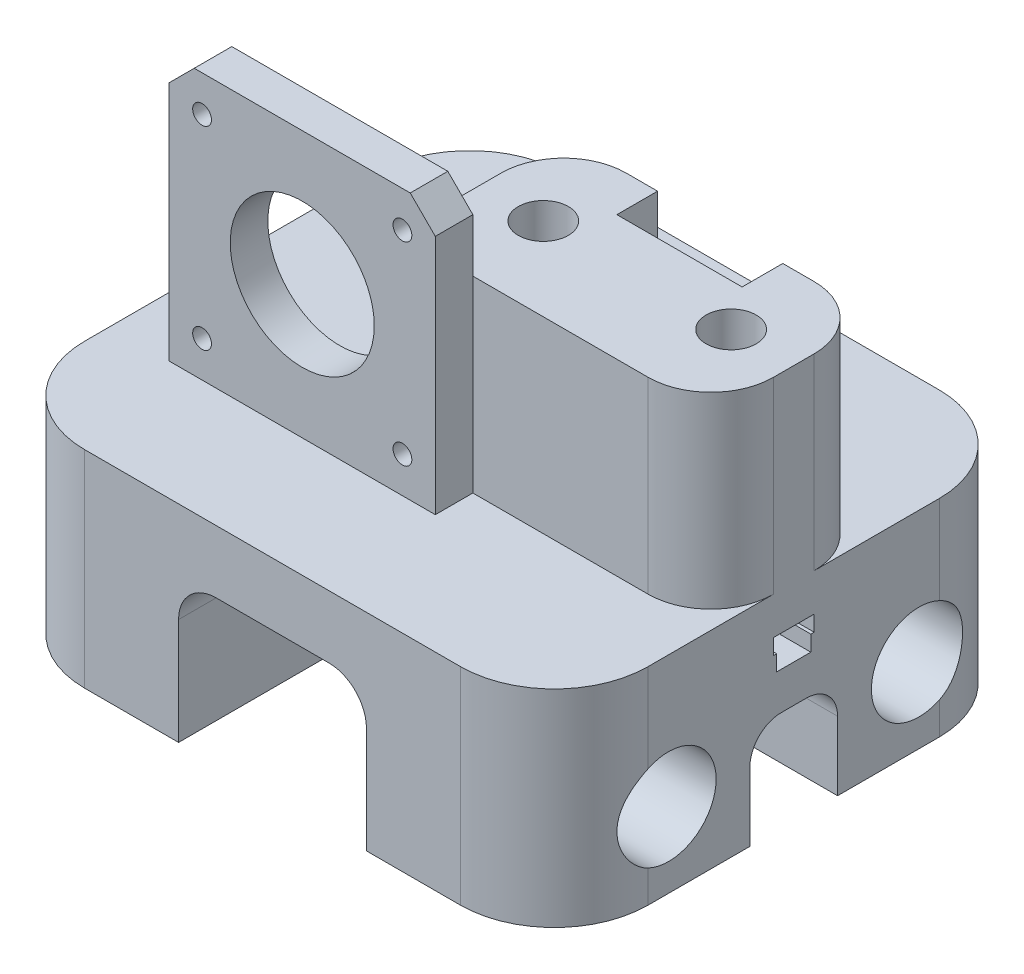
from build123d import *

# Parameters (mm, degrees)
BOSS_EXTRUDE1_DEPTH     = 33
CUT_EXTRUDE1_DEPTH      = 76.5
CUT_EXTRUDE3_DEPTH      = 104.208829564
CUT_EXTRUDE3_DEPTH_BACK = 91
CUT_EXTRUDE4_DEPTH      = 91
CUT_EXTRUDE5_DEPTH      = 25
CUT_EXTRUDE6_START      = -25
SKETCH7_R               = 7.6
CUT_EXTRUDE6_DEPTH      = 25
SKETCH8_W               = 50
SKETCH8_H               = 26.5
SKETCH8_R               = 4
BOSS_EXTRUDE2_DEPTH     = 30
SKETCH12_R              = 11.5
SKETCH12_R_2            = 1.5
BOSS_EXTRUDE5_DEPTH     = 6
SKETCH13_R              = 1
CUT_EXTRUDE7_DEPTH      = 6.5
SKETCH13_3_R            = 1
CUT_EXTRUDE8_DEPTH      = 17
CUT_EXTRUDE9_DEPTH      = 2.5
SKETCH15_5_R            = 1.5
CUT_EXTRUDE12_DEPTH     = 9
CUT_EXTRUDE13_START     = -35
CUT_EXTRUDE13_DEPTH     = 159.544779435
FILLET1_R               = 10
CUT_REVOLVE3_ANGLE      = 90
CUT_EXTRUDE14_DEPTH     = 2
SKETCH29_R              = 2
CUT_EXTRUDE15_DEPTH     = 11


with BuildPart() as part:
    # Sketch1 → Boss-Extrude1 (new body)
    with BuildSketch(Plane(origin=(0, 0, 0), x_dir=(1, 0, 0), z_dir=(0, 1, 0))):
        with BuildLine():
            Line((-15, -7), (-45, -7))
            Line((-45, -7), (-45, -23.25))
            ThreePointArc((-45, -23.25), (-40.606601718, -33.856601718), (-30, -38.25))
            Line((-30, -38.25), (-15, -38.25))
            Line((-15, -38.25), (-15, -7))
        make_face()
        with BuildLine():
            Line((-15, 38.25), (-30, 38.25))
            ThreePointArc((-30, 38.25), (-40.606601718, 33.856601718), (-45, 23.25))
            Line((-45, 23.25), (-45, 7))
            Line((-45, 7), (-15, 7))
            Line((-15, 7), (-15, 38.25))
        make_face()
        with BuildLine():
            Line((45, -23.25), (45, -7))
            Line((45, -7), (15, -7))
            Line((15, -7), (15, -38.25))
            Line((15, -38.25), (30, -38.25))
            ThreePointArc((30, -38.25), (40.606601718, -33.856601718), (45, -23.25))
        make_face()
        with BuildLine():
            Line((30, 38.25), (15, 38.25))
            Line((15, 38.25), (15, 7))
            Line((15, 7), (45, 7))
            Line((45, 7), (45, 23.25))
            ThreePointArc((45, 23.25), (40.606601718, 33.856601718), (30, 38.25))
        make_face()
        Polygon((15, 38.25), (-15, 38.25), (-15, 7), (-45, 7), (-45, -7), (-15, -7), (-15, -38.25), (15, -38.25), (15, -7), (45, -7), (45, 7), (15, 7), align=None)
    extrude(amount=BOSS_EXTRUDE1_DEPTH)

    # Sketch2 → Cut-Extrude1 (cut)
    with BuildSketch(Plane(origin=(0, 0, -38.25), x_dir=(-1, 0, 0), z_dir=(0, 0, -1))):
        with BuildLine():
            Line((-15, 0), (-15, 17))
            ThreePointArc((-15, 17), (-13.242640687, 21.242640687), (-9, 23))
            Line((-9, 23), (9, 23))
            ThreePointArc((9, 23), (13.242640687, 21.242640687), (15, 17))
            Line((15, 17), (15, 0))
            Line((15, 0), (-15, 0))
        make_face()
    extrude(amount=-CUT_EXTRUDE1_DEPTH, mode=Mode.SUBTRACT)

    # Sketch3 → Cut-Extrude3 (cut, two sides: drawn at the far end of the back side and taken through both)
    with BuildSketch(Plane(origin=(45, 0, 0), x_dir=(0, 0, -1), z_dir=(1, 0, 0)).offset(-CUT_EXTRUDE3_DEPTH_BACK)):
        with BuildLine():
            Line((-7, 11), (-7, 0))
            Line((-7, 0), (7, 0))
            Line((7, 0), (7, 11))
            ThreePointArc((7, 11), (5.535533906, 14.535533906), (2, 16))
            Line((2, 16), (-2, 16))
            ThreePointArc((-2, 16), (-5.535533906, 14.535533906), (-7, 11))
        make_face()
    extrude(amount=CUT_EXTRUDE3_DEPTH + CUT_EXTRUDE3_DEPTH_BACK, mode=Mode.SUBTRACT)

    # Sketch5 → Cut-Extrude4 (cut)
    with BuildSketch(Plane(origin=(45, 0, 0), x_dir=(0, 0, -1), z_dir=(1, 0, 0))):
        with BuildLine():
            ThreePointArc((-23.25, 8.200328962), (-17.908349934, 7.458524469), (-15, 12))
            ThreePointArc((-15, 12), (-17.908349934, 16.541475531), (-23.25, 15.799671038))
            Line((-23.25, 15.799671038), (-23.25, 8.200328962))
        make_face()
        with BuildLine():
            Line((-23.25, 8.200328962), (-23.25, 15.799671038))
            ThreePointArc((-23.25, 15.799671038), (-25, 12), (-23.25, 8.200328962))
        make_face()
        with BuildLine():
            ThreePointArc((23.25, 8.200328962), (24.541475531, 9.908349934), (25, 12))
            ThreePointArc((25, 12), (24.541475531, 14.091650066), (23.25, 15.799671038))
            Line((23.25, 15.799671038), (23.25, 8.200328962))
        make_face()
        with BuildLine():
            Line((23.25, 8.200328962), (23.25, 15.799671038))
            ThreePointArc((23.25, 15.799671038), (15, 12), (23.25, 8.200328962))
        make_face()
    extrude(amount=-CUT_EXTRUDE4_DEPTH, mode=Mode.SUBTRACT)

    # Sketch5<3> → Cut-Extrude5 (cut)
    with BuildSketch(Plane(origin=(45, 0, 0), x_dir=(0, 0, -1), z_dir=(1, 0, 0))):
        with BuildLine():
            ThreePointArc((-23.25, 15.799671038), (-17.908349934, 16.541475531), (-15, 12))
            ThreePointArc((-15, 12), (-17.908349934, 7.458524469), (-23.25, 8.200328962))
            Line((-23.25, 8.200328962), (-23.25, 5.129956332))
            ThreePointArc((-23.25, 5.129956332), (-15.93428973, 5.578940897), (-12.4, 12))
            ThreePointArc((-12.4, 12), (-15.93428973, 18.421059103), (-23.25, 18.870043668))
            Line((-23.25, 18.870043668), (-23.25, 15.799671038))
        make_face()
        with BuildLine():
            ThreePointArc((-23.25, 8.200328962), (-25, 12), (-23.25, 15.799671038))
            Line((-23.25, 15.799671038), (-23.25, 18.870043668))
            ThreePointArc((-23.25, 18.870043668), (-27.6, 12), (-23.25, 5.129956332))
            Line((-23.25, 5.129956332), (-23.25, 8.200328962))
        make_face()
        with BuildLine():
            ThreePointArc((23.25, 15.799671038), (24.541475531, 14.091650066), (25, 12))
            ThreePointArc((25, 12), (24.541475531, 9.908349934), (23.25, 8.200328962))
            Line((23.25, 8.200328962), (23.25, 5.129956332))
            ThreePointArc((23.25, 5.129956332), (26.421059103, 7.93428973), (27.6, 12))
            ThreePointArc((27.6, 12), (26.421059103, 16.06571027), (23.25, 18.870043668))
            Line((23.25, 18.870043668), (23.25, 15.799671038))
        make_face()
        with BuildLine():
            ThreePointArc((23.25, 8.200328962), (15, 12), (23.25, 15.799671038))
            Line((23.25, 15.799671038), (23.25, 18.870043668))
            ThreePointArc((23.25, 18.870043668), (12.4, 12), (23.25, 5.129956332))
            Line((23.25, 5.129956332), (23.25, 8.200328962))
        make_face()
    extrude(amount=-CUT_EXTRUDE5_DEPTH, mode=Mode.SUBTRACT)

    # Sketch7 → Cut-Extrude6 (cut)
    with BuildSketch(Plane.ZY.offset(45).offset(CUT_EXTRUDE6_START)):
        with Locations(Location((20, 12, 0), (0, 0, 180))):
            Circle(SKETCH7_R)
        with Locations(Location((-20, 12, 0), (0, 0, 180))):
            Circle(SKETCH7_R)
    extrude(amount=CUT_EXTRUDE6_DEPTH, mode=Mode.SUBTRACT)

    # Sketch8 → Boss-Extrude2 (add)
    with BuildSketch(Plane(origin=(0, 33, 0), x_dir=(1, 0, 0), z_dir=(0, 1, 0))):
        with Locations((20, 0)):
            Rectangle(SKETCH8_W, SKETCH8_H)
        with Locations(Location((5, 0, 0), (0, 0, 270))):
            Circle(SKETCH8_R, mode=Mode.SUBTRACT)
        with Locations(Location((35, 0, 0), (0, 0, 270))):
            Circle(SKETCH8_R, mode=Mode.SUBTRACT)
    extrude(amount=BOSS_EXTRUDE2_DEPTH)

    # Sketch12 → Boss-Extrude5 (add)
    with BuildSketch(Plane.XY.offset(13.25)):
        Polygon((-35.5, 33), (-35.5, 71.5), (-31.5, 75.5), (3, 75.5), (7, 71.5), (7, 33), align=None)
        with Locations(Location((-14.25, 54.25, 0), (0, 0, 36.452681774))):
            Circle(SKETCH12_R, mode=Mode.SUBTRACT)
        with Locations((-30.25, 69.75)):
            Circle(SKETCH12_R_2, mode=Mode.SUBTRACT)
        with Locations((1.75, 69.75)):
            Circle(SKETCH12_R_2, mode=Mode.SUBTRACT)
        with Locations((-30.25, 38.75)):
            Circle(SKETCH12_R_2, mode=Mode.SUBTRACT)
        with Locations((1.75, 38.75)):
            Circle(SKETCH12_R_2, mode=Mode.SUBTRACT)
    extrude(amount=BOSS_EXTRUDE5_DEPTH)

    # Sketch13 → Cut-Extrude7 (cut)
    # profile 1 of 3: a face of its own
    with BuildSketch(Plane(origin=(0, 0, -13.25), x_dir=(-1, 0, 0), z_dir=(0, 0, -1))):
        Polygon((-19, 47.5), (-19, 52.5), (-13, 52.5), (-13, 47.5), (-11, 47.5), (-11, 52.5), (-10, 52.5), (-10, 63), (-30, 63), (-30, 52.5), (-29, 52.5), (-29, 47.5), (-27, 47.5), (-27, 52.5), (-21, 52.5), (-21, 47.5), align=None)
        with Locations((-24.75, 55.7)):
            Circle(SKETCH13_R, mode=Mode.SUBTRACT)
        with Locations((-15.25, 55.7)):
            Circle(SKETCH13_R, mode=Mode.SUBTRACT)
    # profile 2 of 3: a face of its own
    with BuildSketch(Plane(origin=(0, 0, -13.25), x_dir=(-1, 0, 0), z_dir=(0, 0, -1))):
        with Locations((-15.25, 55.7)):
            Circle(SKETCH13_R)
    # profile 3 of 3: a face of its own
    with BuildSketch(Plane(origin=(0, 0, -13.25), x_dir=(-1, 0, 0), z_dir=(0, 0, -1))):
        with Locations((-24.75, 55.7)):
            Circle(SKETCH13_R)
    extrude(amount=-CUT_EXTRUDE7_DEPTH, mode=Mode.SUBTRACT)

    # Sketch13<3> → Cut-Extrude8 (cut)
    with BuildSketch(Plane(origin=(0, 0, -13.25), x_dir=(-1, 0, 0), z_dir=(0, 0, -1))):
        with Locations((-15.25, 55.7)):
            Circle(SKETCH13_3_R)
        with Locations((-24.75, 55.7)):
            Circle(SKETCH13_3_R)
    extrude(amount=-CUT_EXTRUDE8_DEPTH, mode=Mode.SUBTRACT)

    # Sketch15 → Cut-Extrude9 (cut)
    with BuildSketch(Plane(origin=(0, 22, 0), x_dir=(-1, 0, 0), z_dir=(0, -1, 0))):
        Polygon((-38.573279484, -2.725), (-50, -2.725), (-50, 2.725), (-38.573279484, 2.725), (-35.426720516, 2.725), (-33.853441033, 0), (-35.426720516, -2.725), align=None)
        Polygon((-10, -2.725), (-10, 2.725), (-21.426720516, 2.725), (-24.573279484, 2.725), (-26.146558967, 0), (-24.573279484, -2.725), (-21.426720516, -2.725), align=None)
    cut_extrude9 = extrude(amount=-CUT_EXTRUDE9_DEPTH, mode=Mode.SUBTRACT)

    # Sketch15<5> → Cut-Extrude12 (cut)
    with BuildSketch(Plane(origin=(0, 22, 0), x_dir=(-1, 0, 0), z_dir=(0, -1, 0))):
        with Locations(Location((-37, 0, 0), (0, 0, 90))):
            Circle(SKETCH15_5_R)
        with Locations(Location((-23, 0, 0), (0, 0, 270))):
            Circle(SKETCH15_5_R)
    cut_extrude12 = extrude(amount=CUT_EXTRUDE12_DEPTH, mode=Mode.SUBTRACT)

    # Sketch16 → Cut-Extrude13 (cut)
    with BuildSketch(Plane(origin=(45, 0, 0), x_dir=(0, 0, -1), z_dir=(1, 0, 0)).offset(CUT_EXTRUDE13_START)):
        Polygon((3.25, 24.5), (2.725, 24.5), (-2.725, 24.5), (-3.25, 24.5), (-3.25, 27), (3.25, 27), align=None)
    cut_extrude13 = extrude(amount=CUT_EXTRUDE13_DEPTH, mode=Mode.SUBTRACT)

    # Mirror1: Cut-Extrude9, Cut-Extrude12, Cut-Extrude13 across plane
    add(cut_extrude9.mirror(Plane(origin=(0, 0, 0), x_dir=(0, 0, 1), z_dir=(1, 0, 0))), mode=Mode.SUBTRACT)
    add(cut_extrude12.mirror(Plane(origin=(0, 0, 0), x_dir=(0, 0, 1), z_dir=(1, 0, 0))), mode=Mode.SUBTRACT)
    add(cut_extrude13.mirror(Plane(origin=(0, 0, 0), x_dir=(0, 0, 1), z_dir=(1, 0, 0))), mode=Mode.SUBTRACT)

    # Fillet1
    fillet1_edges = [part.edges().sort_by_distance(p)[0] for p in [
        (-5, 48, -13.25),
        (45, 48, 13.25),
        (45, 48, -13.25),
    ]]
    fillet(fillet1_edges, radius=FILLET1_R)

    # Sketch27 → Cut-Revolve3 (revolve, cut)
    with BuildSketch(Plane(origin=(-18.537047764, 8.601190163, 0), x_dir=(0, 0, 1), z_dir=(-0.907107934529866, 0.4208980816218579, 0))):
        Polygon((-2.725, 14.770910194), (2.725, 14.770910194), (3.25, 14.770910194), (3.25, 20.282933416), (-3.25, 20.282933416), (-3.25, 14.770910194), align=None)
    cut_revolve3 = revolve(axis=Axis((-12.32, 22, -2.725), (0, 0, -1)), revolution_arc=CUT_REVOLVE3_ANGLE, mode=Mode.SUBTRACT)

    # Mirror2: Cut-Revolve3 across plane
    add(cut_revolve3.mirror(Plane(origin=(0, 0, 0), x_dir=(0, 0, 1), z_dir=(1, 0, 0))), mode=Mode.SUBTRACT)

    # Sketch26 → Cut-Extrude14 (cut)
    with BuildSketch(Plane.ZY.offset(12.32)):
        Polygon((2.725, 22), (3.25, 22), (3.25, 24.5), (3.25, 27), (-3.25, 27), (-3.25, 24.5), (-3.25, 22), (-2.725, 22), align=None)
    cut_extrude14 = extrude(amount=-CUT_EXTRUDE14_DEPTH, mode=Mode.SUBTRACT)

    # Mirror3: Cut-Extrude14 across plane
    add(cut_extrude14.mirror(Plane(origin=(0, 0, 0), x_dir=(0, 0, 1), z_dir=(1, 0, 0))), mode=Mode.SUBTRACT)

    # Sketch29 → Cut-Extrude15 (cut)
    with BuildSketch(Plane(origin=(0, 33, 0), x_dir=(1, 0, 0), z_dir=(0, 1, 0))):
        with Locations(Location((7, 15.25, 0), (0, 0, 270))):
            Circle(SKETCH29_R)
    extrude(amount=-CUT_EXTRUDE15_DEPTH, mode=Mode.SUBTRACT)


solid = part.part
